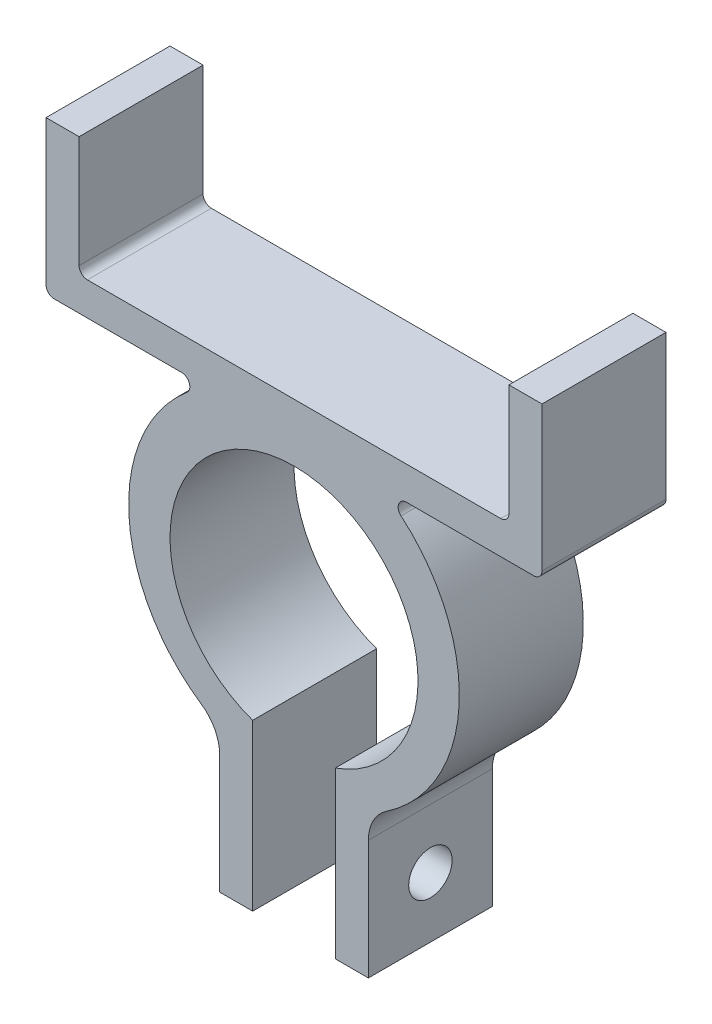
from build123d import *

# Parameters (mm, degrees)
BOSS_EXTRUDE1_DEPTH = 15
SKETCH2_R           = 2.625
CUT_EXTRUDE1_DEPTH  = 10
FILLET3_R           = 5
FILLET5_R           = 1
FILLET6_R           = 1
SKETCH3_R           = 1.5
CUT_EXTRUDE4_DEPTH  = 58


with BuildPart() as part:
    # Sketch1 → Boss-Extrude1 (new body)
    with BuildSketch(Plane.XY):
        with BuildLine():
            ThreePointArc((-5, -15.142135624), (0, 14), (5, -15.142135624))
            Line((5, -15.142135624), (5, -35.142135624))
            Line((5, -35.142135624), (9, -35.142135624))
            Line((9, -35.142135624), (9, -17.860571099))
            ThreePointArc((9, -17.860571099), (19.980623019, -0.880172578), (10.535653753, 17))
            Line((10.535653753, 17), (30, 17))
            Line((30, 17), (30, 35.5))
            Line((30, 35.5), (26, 35.5))
            Line((26, 35.5), (26, 21))
            Line((26, 21), (-26, 21))
            Line((-26, 21), (-26, 35.5))
            Line((-26, 35.5), (-30, 35.5))
            Line((-30, 35.5), (-30, 17))
            Line((-30, 17), (-10.535653753, 17))
            ThreePointArc((-10.535653753, 17), (-19.980623019, -0.880172578), (-9, -17.860571099))
            Line((-9, -17.860571099), (-9, -35.142135624))
            Line((-9, -35.142135624), (-5, -35.142135624))
            Line((-5, -35.142135624), (-5, -15.142135624))
        make_face()
    extrude(amount=BOSS_EXTRUDE1_DEPTH)

    # Sketch2 → Cut-Extrude1 (cut)
    with BuildSketch(Plane(origin=(9, 0, 0), x_dir=(0, 0, -1), z_dir=(1, 0, 0))):
        with Locations(Location((-7.5, -27.860571099, 0), (0, 0, 90))):
            Circle(SKETCH2_R)
    extrude(amount=-CUT_EXTRUDE1_DEPTH, mode=Mode.SUBTRACT)

    # Fillet3
    fillet3_edges = [part.edges().sort_by_distance(p)[0] for p in [
        (9, -17.860571099, 7.5),
        (-9, -17.860571099, 7.5),
    ]]
    fillet(fillet3_edges, radius=FILLET3_R)

    # Fillet5
    fillet5_edges = [part.edges().sort_by_distance(p)[0] for p in [
        (10.535653753, 17, 7.5),
        (-10.535653753, 17, 7.5),
    ]]
    fillet(fillet5_edges, radius=FILLET5_R)

    # Fillet6
    fillet6_edges = [part.edges().sort_by_distance(p)[0] for p in [
        (26, 21, 7.5),
        (-26, 21, 7.5),
        (-30, 17, 7.5),
        (30, 17, 7.5),
    ]]
    fillet(fillet6_edges, radius=FILLET6_R)

    # Sketch3 → Cut-Extrude4 (cut)
    with BuildSketch(Plane(origin=(30, 0, 0), x_dir=(0, 0, -1), z_dir=(1, 0, 0))):
        with Locations((-7.5, 15.238095238)):
            Circle(SKETCH3_R)
    extrude(amount=-CUT_EXTRUDE4_DEPTH, mode=Mode.SUBTRACT)


solid = part.part
